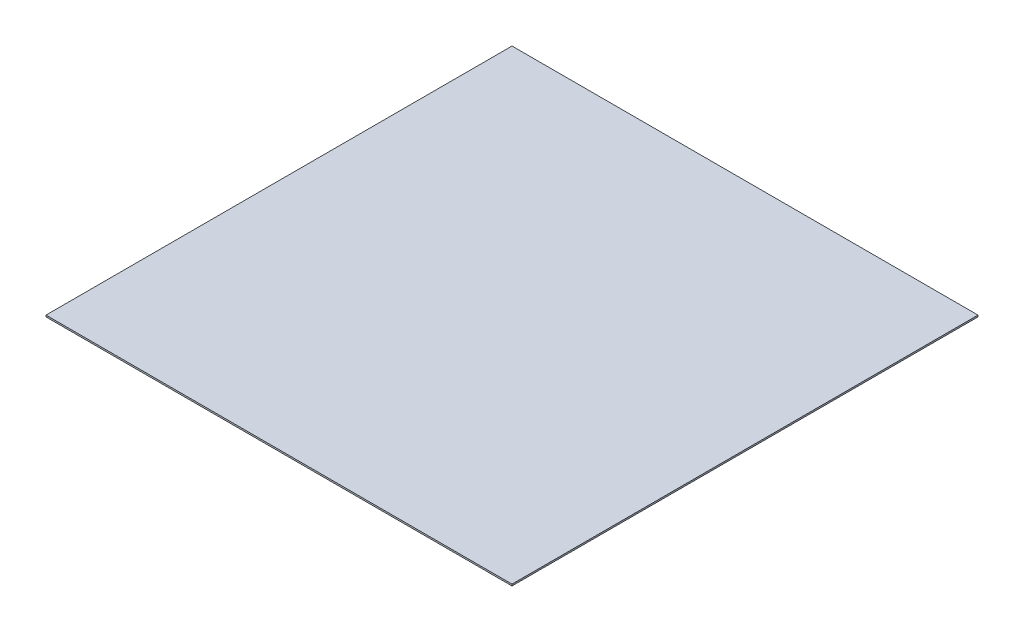
from build123d import *

# Parameters (mm, degrees)
SKETCH1_W          = 914.4
SKETCH1_H          = 914.4
SQUARE_BOARD_DEPTH = 3.175


with BuildPart() as part:
    # Sketch1 → Square Board (new body)
    with BuildSketch(Plane(origin=(0, 0, 0), x_dir=(1, 0, 0), z_dir=(0, 1, 0))):
        Rectangle(SKETCH1_W, SKETCH1_H)
    extrude(amount=SQUARE_BOARD_DEPTH)


solid = part.part
